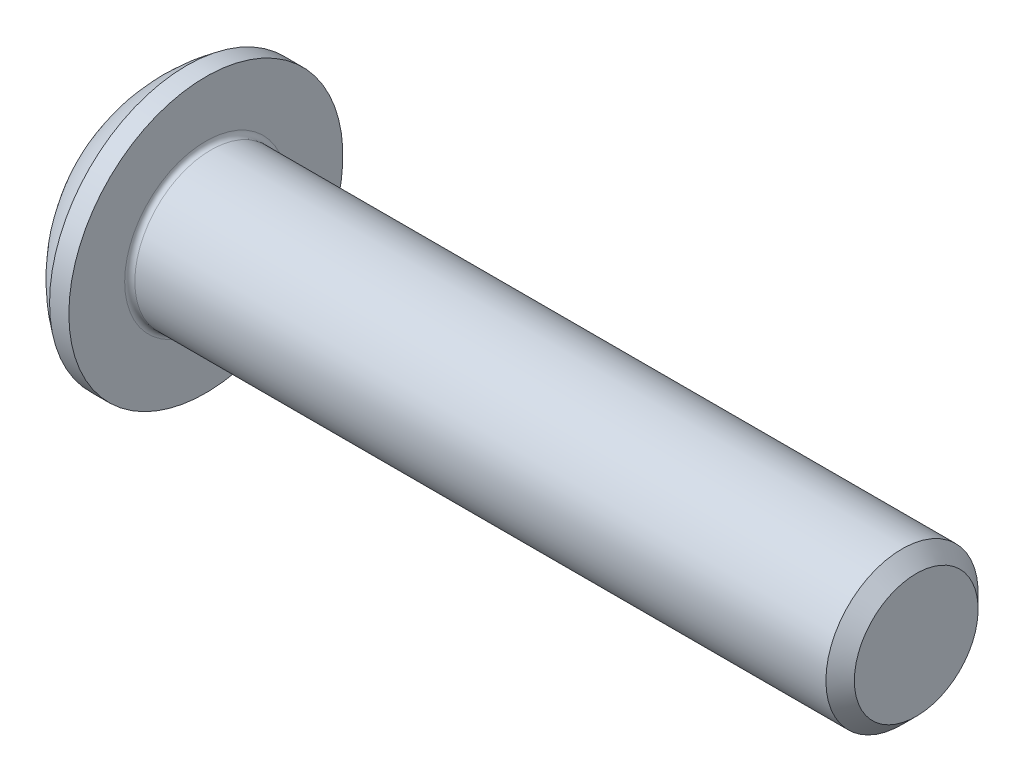
from build123d import *

# Parameters (mm, degrees)
FILLET1_R   = 0.1
HEX_2_DEPTH = 1.04


with BuildPart() as part:
    # BodySke → BaseBody (revolve)
    with BuildSketch(Plane.XY, mode=Mode.PRIVATE) as basebody_sk:
        with BuildLine():
            Line((15.5, 0), (15.5, 1.2195))
            Line((15.5, 1.2195), (15.2195, 1.5))
            Line((15.2195, 1.5), (1.5, 1.5))
            Line((1.5, 1.5), (1.5, 2.7))
            Line((1.5, 2.7), (1.12, 2.7))
            ThreePointArc((1.12, 2.7), (0.468385973, 2.101005712), (0, 1.35))
            Line((0, 1.35), (0, 0))
            Line((0, 0), (15.5, 0))
        make_face()
    revolve(basebody_sk.sketch.rotate(Axis((0, 0, 0), (1, 0, 0)), 90), axis=Axis((0, 0, 0), (1, 0, 0)))

    # Fillet1
    fillet1_edges = [part.edges().sort_by_distance(p)[0] for p in [
        (1.5, 0, -1.5),
    ]]
    fillet(fillet1_edges, radius=FILLET1_R)

    # Sketch2 → PreBroach (revolve, cut)
    with BuildSketch(Plane.XY, mode=Mode.PRIVATE) as prebroach_sk:
        Polygon((0, 1), (1.04, 1), (1.617350269, 0), (0, 0), align=None)
    revolve(prebroach_sk.sketch.rotate(Axis((0, 0, 0), (1, 0, 0)), 90), axis=Axis((0, 0, 0), (1, 0, 0)), mode=Mode.SUBTRACT)

    # Sketch3 → Hex 2 (cut)
    with BuildSketch(Plane(origin=(0, 0, 0), x_dir=(0, 0, -1), z_dir=(1, 0, 0))):
        Polygon((-1, -0.577350269), (-1, 0.577350269), (0, 1.154700538), (1, 0.577350269), (1, -0.577350269), (0, -1.154700538), align=None)
    extrude(amount=HEX_2_DEPTH, mode=Mode.SUBTRACT)


solid = part.part
